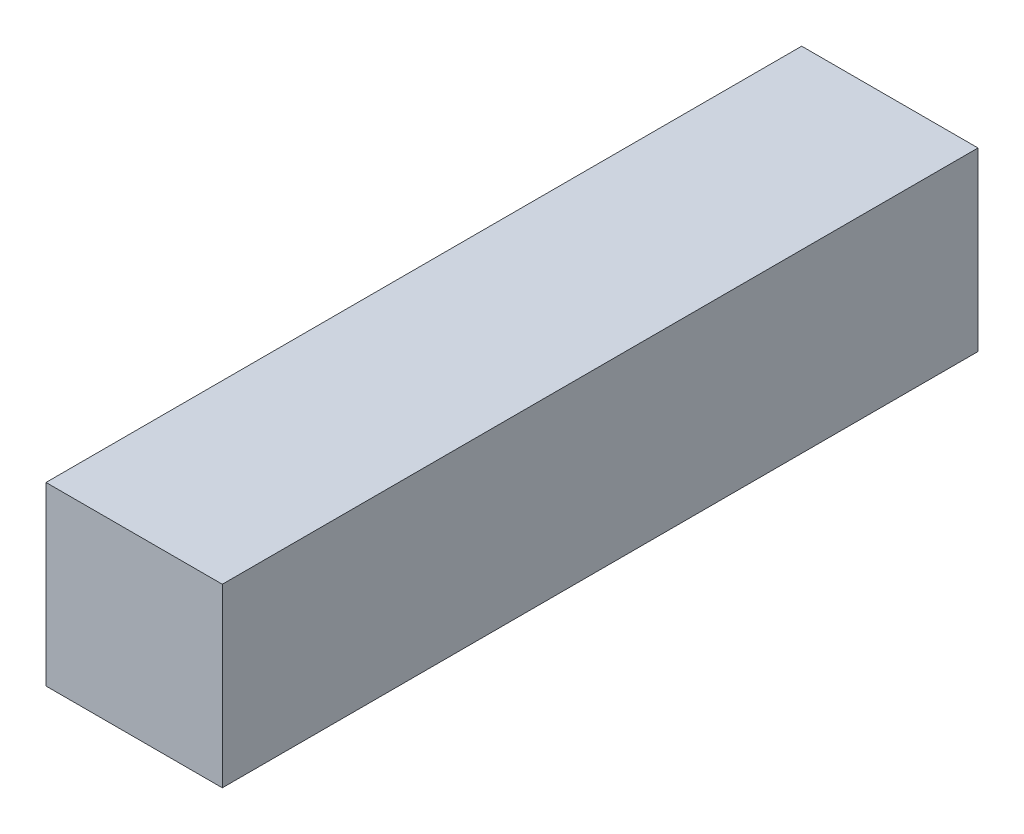
from build123d import *

# Parameters (mm, degrees)
SKETCH1_W           = 2.8
SKETCH1_H           = 2.8
BOSS_EXTRUDE1_DEPTH = 12


with BuildPart() as part:
    # Sketch1 → Boss-Extrude1 (new body)
    with BuildSketch(Plane.XY):
        with Locations((1.4, 1.4)):
            Rectangle(SKETCH1_W, SKETCH1_H)
    extrude(amount=BOSS_EXTRUDE1_DEPTH)


solid = part.part
